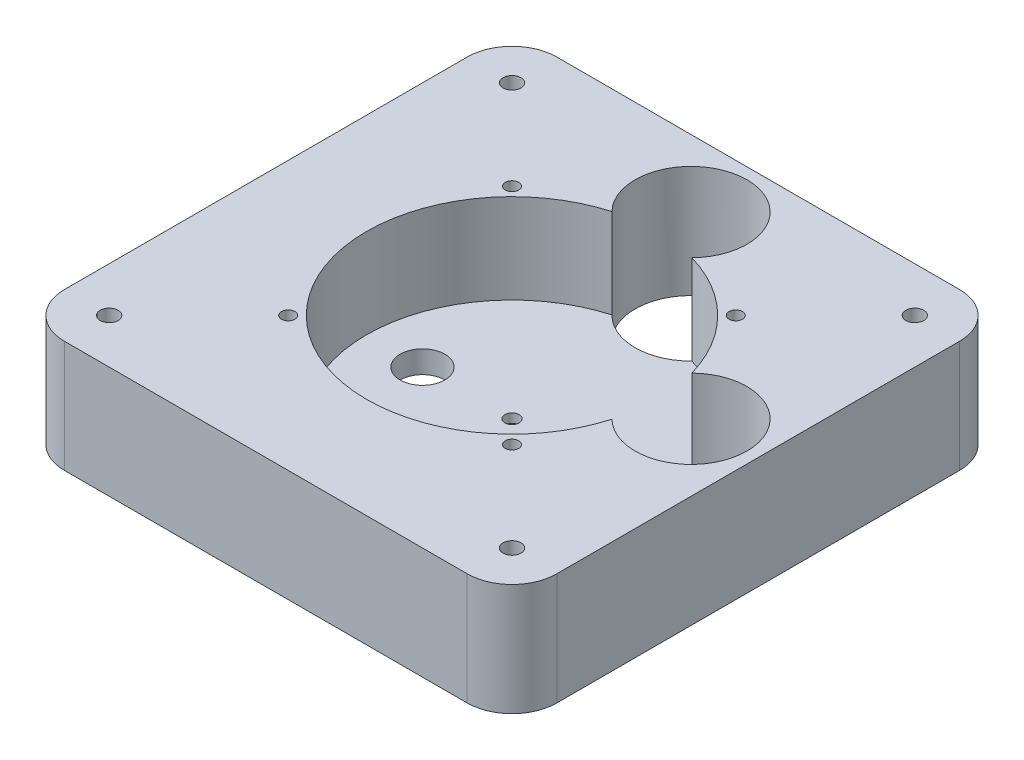
from build123d import *

# Parameters (mm, degrees)
SKETCH_1_W          = 130
SKETCH_1_H          = 130
SKETCH_1_R          = 1.6
EXTRUDE_1_DEPTH     = 25
SKETCH_2_R          = 5
EXTRUDE_2_DEPTH     = 5
SKETCH_3_R          = 1.5
SKETCH_3_R_2        = 2
CUT_EXTRUDE_1_DEPTH = 103.102889283
FILLET_1_R          = 10
SKETCH_4_R          = 1.6
CUT_EXTRUDE_2_DEPTH = 10
CUT_EXTRUDE_START   = -10
SKETCH_5_R          = 12.5
CUT_EXTRUDE_3_DEPTH = 10
SKETCH_6_OUTSIDE_W  = 169.108
SKETCH_6_OUTSIDE_H  = 169.108
CUT_EXTRUDE_4_DEPTH = 103.102889283
SKETCH_7_R          = 3.5
CUT_EXTRUDE_5_DEPTH = 3
SKETCH_9_R          = 3.5
CUT_EXTRUDE_6_DEPTH = 5
EXTRUDE_START       = -20
SKETCH_10_R         = 1.6
EXTRUDE_3_DEPTH     = 20
EXTRUDE_START_2     = -13
SKETCH_11_R         = 1.5
EXTRUDE_4_DEPTH     = 13


with BuildPart() as part:
    # 草图1 → 凸台-拉伸1 (new body)
    with BuildSketch(Plane(origin=(0, 0, 0), x_dir=(1, 0, 0), z_dir=(0, 1, 0))):
        with Locations((5, 5)):
            Rectangle(SKETCH_1_W, SKETCH_1_H)
        with Locations(Location((61.920310217, 0, 0), (0, 0, 270))):
            Circle(SKETCH_1_R, mode=Mode.SUBTRACT)
        with Locations(Location((40, -21.920310217, 0), (0, 0, 270))):
            Circle(SKETCH_1_R, mode=Mode.SUBTRACT)
        with Locations(Location((40, 21.920310217, 0), (0, 0, 270))):
            Circle(SKETCH_1_R, mode=Mode.SUBTRACT)
        with Locations(Location((21.920310217, 40, 0), (0, 0, 270))):
            Circle(SKETCH_1_R, mode=Mode.SUBTRACT)
        with Locations(Location((-21.920310217, 40, 0), (0, 0, 270))):
            Circle(SKETCH_1_R, mode=Mode.SUBTRACT)
        with Locations(Location((0, 61.920310217, 0), (0, 0, 270))):
            Circle(SKETCH_1_R, mode=Mode.SUBTRACT)
        with BuildLine():
            ThreePointArc((-8.926785536, 31.25), (-22.980970389, -22.980970389), (31.25, -8.926785536))
            ThreePointArc((31.25, -8.926785536), (52.5, 0), (31.25, 8.926785536))
            ThreePointArc((31.25, 8.926785536), (22.980970389, 22.980970389), (8.926785536, 31.25))
            ThreePointArc((8.926785536, 31.25), (0, 52.5), (-8.926785536, 31.25))
        make_face(mode=Mode.SUBTRACT)
    extrude(amount=EXTRUDE_1_DEPTH)

    # 草图2 → 凸台-拉伸2 (add)
    with BuildSketch(Plane.XZ):
        with BuildLine():
            ThreePointArc((-8.926785536, -31.25), (0, -52.5), (8.926785536, -31.25))
            ThreePointArc((8.926785536, -31.25), (22.980970389, -22.980970389), (31.25, -8.926785536))
            ThreePointArc((31.25, -8.926785536), (52.5, 0), (31.25, 8.926785536))
            ThreePointArc((31.25, 8.926785536), (-22.980970389, 22.980970389), (-8.926785536, -31.25))
        make_face()
        with Locations(Location((-20, 0, 0), (0, 0, 270))):
            Circle(SKETCH_2_R, mode=Mode.SUBTRACT)
    extrude(amount=-EXTRUDE_2_DEPTH)

    # 草图3 → 切除-拉伸1 (cut, through all)
    with BuildSketch(Plane(origin=(0, 25, 0), x_dir=(1, 0, 0), z_dir=(0, 1, 0))):
        with Locations(Location((-25, 25, 0), (0, 0, 270))):
            Circle(SKETCH_3_R)
        with Locations(Location((25, 25, 0), (0, 0, 270))):
            Circle(SKETCH_3_R)
        with Locations(Location((-25, -25, 0), (0, 0, 270))):
            Circle(SKETCH_3_R)
        with Locations(Location((25, -25, 0), (0, 0, 270))):
            Circle(SKETCH_3_R)
        with Locations(Location((-45, 45, 0), (0, 0, 270))):
            Circle(SKETCH_3_R_2)
        with Locations(Location((45, 45, 0), (0, 0, 270))):
            Circle(SKETCH_3_R_2)
        with Locations(Location((45, -45, 0), (0, 0, 270))):
            Circle(SKETCH_3_R_2)
        with Locations(Location((-45, -45, 0), (0, 0, 270))):
            Circle(SKETCH_3_R_2)
    extrude(amount=-CUT_EXTRUDE_1_DEPTH, mode=Mode.SUBTRACT)

    # 圆角1
    fillet_1_edges = [part.edges().sort_by_distance(p)[0] for p in [
        (-60, 12.5, -70),
        (70, 12.5, -70),
        (70, 12.5, 60),
        (-60, 12.5, 60),
    ]]
    fillet(fillet_1_edges, radius=FILLET_1_R)

    # 草图4 → 切除-拉伸2 (cut)
    with BuildSketch(Plane(origin=(0, 5, 0), x_dir=(1, 0, 0), z_dir=(0, 1, 0))):
        with Locations(Location((0, 0, 0), (0, 0, 270))):
            Circle(SKETCH_4_R)
    extrude(amount=-CUT_EXTRUDE_2_DEPTH, mode=Mode.SUBTRACT)

    # 草图5 → 切除-拉伸3 (cut)
    with BuildSketch(Plane(origin=(0, 5, 0), x_dir=(1, 0, 0), z_dir=(0, 1, 0)).offset(CUT_EXTRUDE_START)):
        with Locations(Location((40, 0, 0), (0, 0, 134.427004001))):
            Circle(SKETCH_5_R)
        with Locations(Location((0, 40, 0), (0, 0, 315.572995999))):
            Circle(SKETCH_5_R)
    extrude(amount=CUT_EXTRUDE_3_DEPTH, mode=Mode.SUBTRACT)

    # 草图6 outside → 切除-拉伸4 (cut, through all)
    with BuildSketch(Plane(origin=(0, 25, 0), x_dir=(1, 0, 0), z_dir=(0, 1, 0))):
        with Locations((5, 5)):
            Rectangle(SKETCH_6_OUTSIDE_W, SKETCH_6_OUTSIDE_H)
        with BuildLine():
            Line((45, -55), (-45, -55))
            ThreePointArc((-45, -55), (-52.071067812, -52.071067812), (-55, -45))
            Line((-55, -45), (-55, 45))
            ThreePointArc((-55, 45), (-52.071067812, 52.071067812), (-45, 55))
            Line((-45, 55), (45, 55))
            ThreePointArc((45, 55), (52.071067812, 52.071067812), (55, 45))
            Line((55, 45), (55, -45))
            ThreePointArc((55, -45), (52.071067812, -52.071067812), (45, -55))
        make_face(mode=Mode.SUBTRACT)
    extrude(amount=-CUT_EXTRUDE_4_DEPTH, mode=Mode.SUBTRACT)

    # 草图7 → 切除-拉伸5 (cut)
    with BuildSketch(Plane.XZ):
        with Locations(Location((0, 0, 0), (0, 0, 270))):
            Circle(SKETCH_7_R)
    extrude(amount=-CUT_EXTRUDE_5_DEPTH, mode=Mode.SUBTRACT)

    # 草图9 → 切除-拉伸6 (cut)
    with BuildSketch(Plane.XZ):
        with Locations(Location((-21.920310217, -40, 0), (0, 0, 270))):
            Circle(SKETCH_9_R)
        with Locations(Location((21.920310217, -40, 0), (0, 0, 270))):
            Circle(SKETCH_9_R)
        with Locations(Location((40, -21.920310217, 0), (0, 0, 270))):
            Circle(SKETCH_9_R)
        with Locations(Location((40, 21.920310217, 0), (0, 0, 270))):
            Circle(SKETCH_9_R)
        with Locations(Location((-47, 25, 0), (0, 0, 270))):
            Circle(SKETCH_9_R)
        with Locations(Location((-47, -25, 0), (0, 0, 270))):
            Circle(SKETCH_9_R)
    extrude(amount=-CUT_EXTRUDE_6_DEPTH, mode=Mode.SUBTRACT)

    # 草图10 → 凸台-拉伸3 (add)
    with BuildSketch(Plane(origin=(0, 25, 0), x_dir=(1, 0, 0), z_dir=(0, 1, 0)).offset(EXTRUDE_START)):
        with Locations((40, 21.920310217)):
            Circle(SKETCH_10_R)
        with Locations((40, -21.920310217)):
            Circle(SKETCH_10_R)
        with Locations((-21.920310217, 40)):
            Circle(SKETCH_10_R)
        with Locations((21.920310217, 40)):
            Circle(SKETCH_10_R)
    extrude(amount=EXTRUDE_3_DEPTH)

    # 草图11 → 凸台-拉伸4 (add)
    with BuildSketch(Plane.XZ.offset(EXTRUDE_START_2)):
        with Locations(Location((25, 25, 0), (0, 0, 90))):
            Circle(SKETCH_11_R)
        with Locations(Location((-25, 25, 0), (0, 0, 90))):
            Circle(SKETCH_11_R)
        with Locations(Location((-25, -25, 0), (0, 0, 90))):
            Circle(SKETCH_11_R)
        with Locations(Location((25, -25, 0), (0, 0, 90))):
            Circle(SKETCH_11_R)
    extrude(amount=EXTRUDE_4_DEPTH)


solid = part.part
